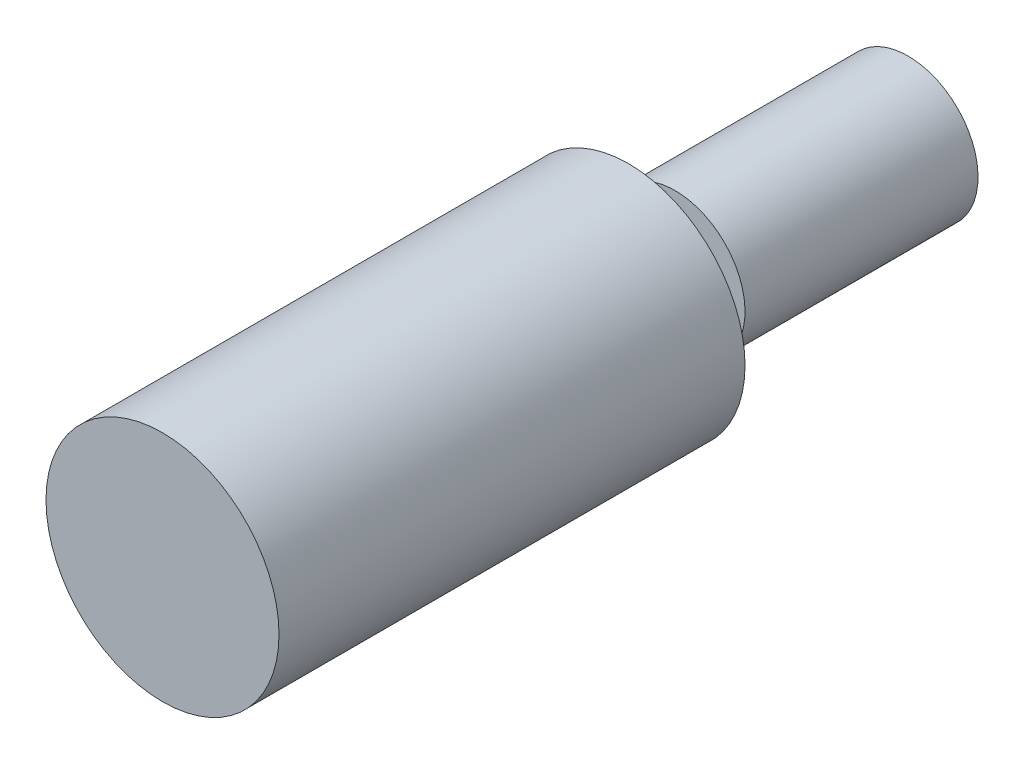
from build123d import *


with BuildPart() as part:
    # Sketch1 → Revolve1 (revolve)
    with BuildSketch(Plane.XZ):
        Polygon((0, 10), (2.5, 10), (2.5, 0), (1, 0), (1, -1), (1.5, -1), (1.5, -6), (0, -6), align=None)
    revolve(axis=Axis((0, 0, 44.681241357), (0, 0, -1)))


solid = part.part
